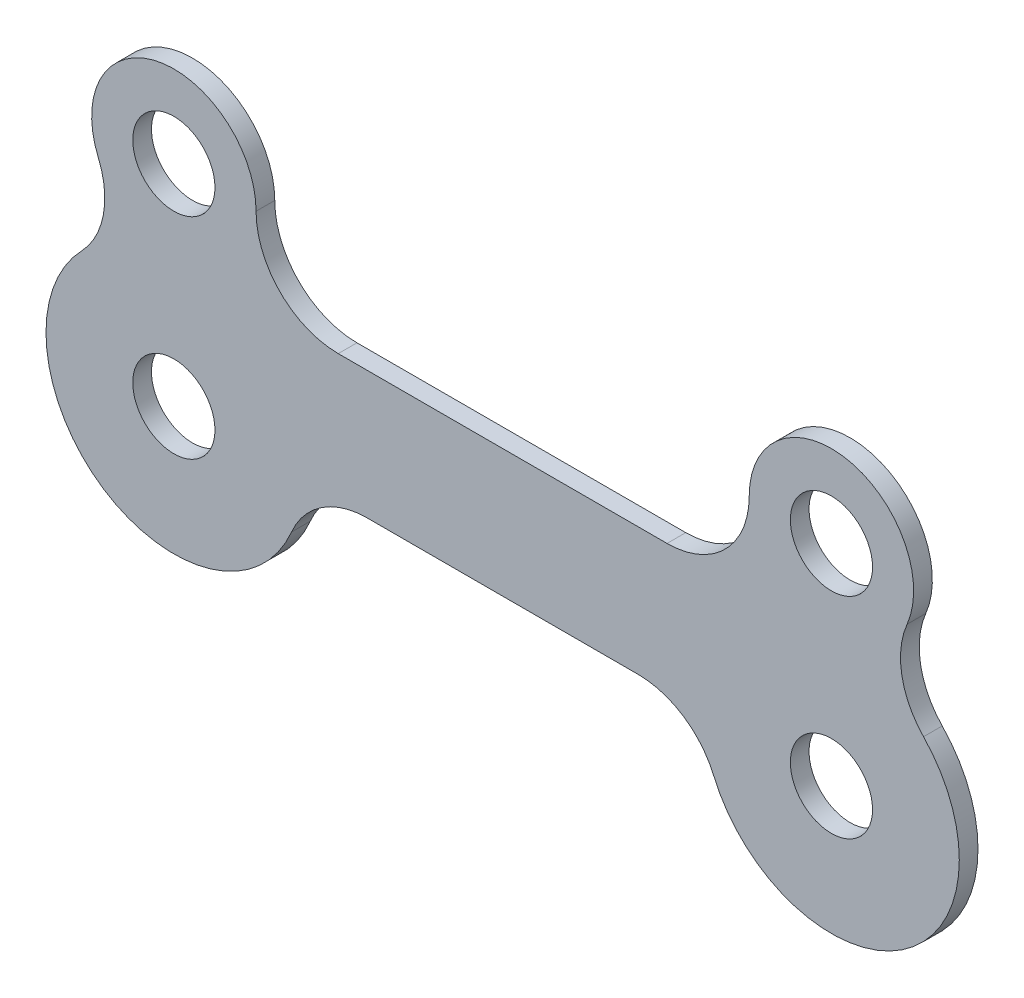
from build123d import *

# Parameters (mm, degrees)
SKETCH1_R           = 1.7859375
BOSS_EXTRUDE1_DEPTH = 0.8128


with BuildPart() as part:
    # Sketch1 → Boss-Extrude1 (new body)
    with BuildSketch(Plane.XY):
        with BuildLine():
            ThreePointArc((5.113201981, -2.174184805), (6.429738102, -0.592725316), (8.400260413, 0))
            Line((8.400260413, 0), (20.174739587, 0))
            ThreePointArc((20.174739587, 0), (22.145261898, -0.592725316), (23.461798019, -2.174184805))
            ThreePointArc((23.461798019, -2.174184805), (31.640256951, -4.634232826), (32.576636291, 3.854714135))
            ThreePointArc((32.576636291, 3.854714135), (31.636446649, 5.685103372), (31.862058429, 7.730434799))
            ThreePointArc((31.862058429, 7.730434799), (29.288207259, 12.628071631), (25.003125, 9.128125))
            ThreePointArc((25.003125, 9.128125), (23.956947034, 6.602427966), (21.43125, 5.55625))
            Line((21.43125, 5.55625), (7.14375, 5.55625))
            ThreePointArc((7.14375, 5.55625), (4.618052966, 6.602427966), (3.571875, 9.128125))
            ThreePointArc((3.571875, 9.128125), (-0.713207259, 12.628071631), (-3.287058429, 7.730434799))
            ThreePointArc((-3.287058429, 7.730434799), (-3.061446655, 5.68510334), (-4.001636336, 3.854714088))
            ThreePointArc((-4.001636336, 3.854714088), (-3.065256924, -4.634232844), (5.113201981, -2.174184805))
        make_face()
        Circle(SKETCH1_R, mode=Mode.SUBTRACT)
        with Locations((28.575, 0)):
            Circle(SKETCH1_R, mode=Mode.SUBTRACT)
        with Locations((0, 9.128125)):
            Circle(SKETCH1_R, mode=Mode.SUBTRACT)
        with Locations((28.575, 9.128125)):
            Circle(SKETCH1_R, mode=Mode.SUBTRACT)
    extrude(amount=BOSS_EXTRUDE1_DEPTH)


solid = part.part
